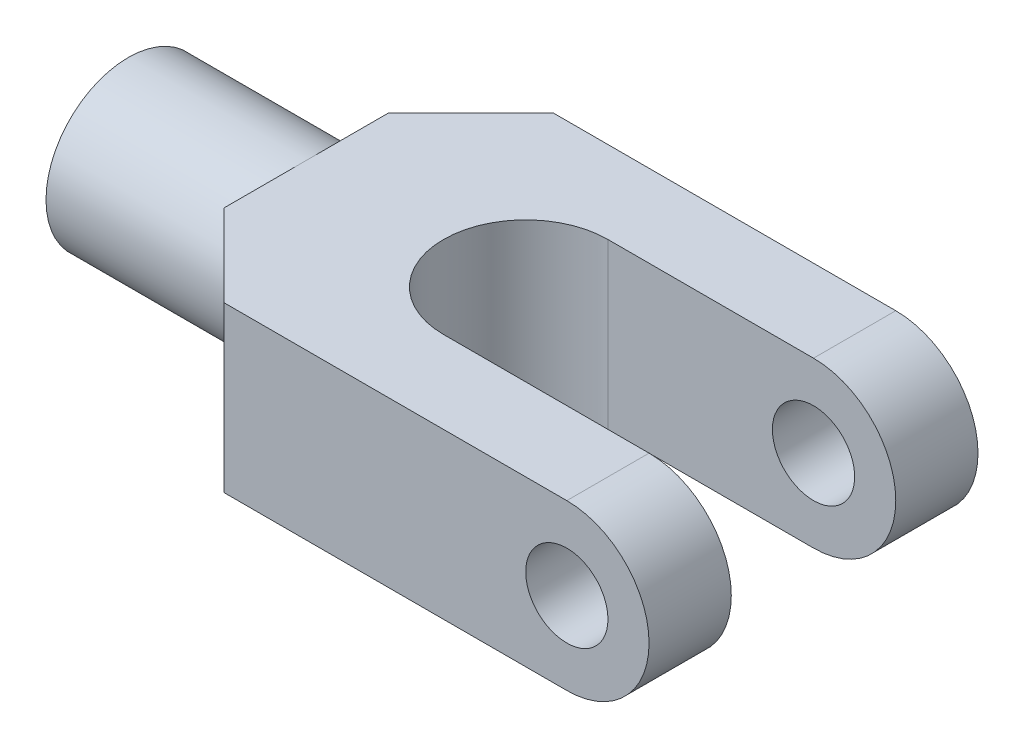
from build123d import *

# Parameters (mm, degrees)
SKETCH1_R               = 3
BOSS_EXTRUDE1_DEPTH     = 12
CUT_EXTRUDE1_DEPTH      = 34.778691508
CUT_EXTRUDE1_DEPTH_BACK = 34.778691508
SKETCH3_R               = 6
SKETCH3_R_2             = 3
BOSS_EXTRUDE2_DEPTH     = 13


with BuildPart() as part:
    # Sketch1 → Boss-Extrude1 (new, symmetric)
    with BuildSketch(Plane.XY):
        with BuildLine():
            Line((0, -6), (-31, -6))
            Line((-31, -6), (-31, 6))
            Line((-31, 6), (0, 6))
            ThreePointArc((0, 6), (6, 0), (0, -6))
        make_face()
        Circle(SKETCH1_R, mode=Mode.SUBTRACT)
    extrude(amount=BOSS_EXTRUDE1_DEPTH, both=True)

    # Sketch2 → Cut-Extrude1 (cut, two sides: drawn at the far end of the back side and taken through both)
    with BuildSketch(Plane(origin=(0, 0, 0), x_dir=(1, 0, 0), z_dir=(0, 1, 0)).offset(-CUT_EXTRUDE1_DEPTH_BACK)):
        with BuildLine():
            Line((-15, 6), (6, 6))
            Line((6, 6), (6, -6))
            Line((6, -6), (-15, -6))
            ThreePointArc((-15, -6), (-21, 0), (-15, 6))
        make_face()
        Polygon((-31, 6), (-25, 12), (-31, 12), align=None)
        Polygon((-31, -12), (-31, -6), (-25, -12), align=None)
    extrude(amount=CUT_EXTRUDE1_DEPTH + CUT_EXTRUDE1_DEPTH_BACK, mode=Mode.SUBTRACT)

    # Sketch3 → Boss-Extrude2 (add)
    with BuildSketch(Plane.ZY.offset(31)):
        Circle(SKETCH3_R)
        with Locations(Location((0, 0, 0), (0, 0, 180))):
            Circle(SKETCH3_R_2, mode=Mode.SUBTRACT)
    extrude(amount=BOSS_EXTRUDE2_DEPTH)


solid = part.part
